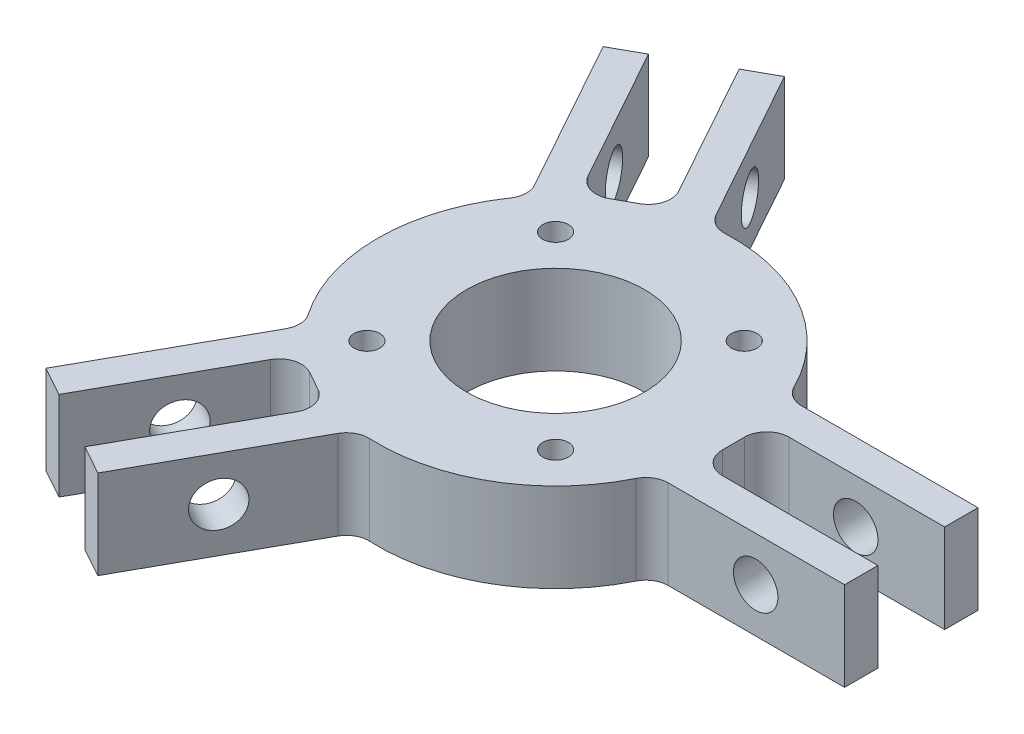
from build123d import *

# Parameters (mm, degrees)
SKETCH1_R                             = 12.7
SKETCH1_R_2                           = 1.8288
BOSS_EXTRUDE1_DEPTH                   = 6.35
F_1_4_0_25_DIAMETER_HOLE1_D           = 6.35
F_1_4_0_25_DIAMETER_HOLE1_ON_FACE_2_D = 6.35
F_1_4_0_25_DIAMETER_HOLE1_ON_FACE_3_D = 6.35
F_1_4_0_25_DIAMETER_HOLE1_ON_FACE_4_D = 6.35
F_1_4_0_25_DIAMETER_HOLE1_ON_FACE_5_D = 6.35
F_1_4_0_25_DIAMETER_HOLE1_ON_FACE_6_D = 6.35
FILLET1_R                             = 3.175


with BuildPart() as part:
    # Sketch1 → Boss-Extrude1 (new, symmetric)
    with BuildSketch(Plane(origin=(0, 0, 0), x_dir=(1, 0, 0), z_dir=(0, 1, 0))):
        with BuildLine():
            Line((25.4, 4.7625), (25.4, -4.7625))
            Line((25.4, -4.7625), (50.8, -4.7625))
            Line((50.8, -4.7625), (50.8, -9.525))
            Line((50.8, -9.525), (23.546430197, -9.525))
            ThreePointArc((23.546430197, -9.525), (12.881044339, -21.891521115), (-3.108809324, -25.209032202))
            Line((-3.108809324, -25.209032202), (-16.344312849, -49.032938546))
            Line((-16.344312849, -49.032938546), (-20.507486876, -46.720064087))
            Line((-20.507486876, -46.720064087), (-8.172156424, -24.516469273))
            Line((-8.172156424, -24.516469273), (-16.498504479, -19.890720354))
            Line((-16.498504479, -19.890720354), (-28.833834931, -42.094315167))
            Line((-28.833834931, -42.094315167), (-32.997008959, -39.781440707))
            Line((-32.997008959, -39.781440707), (-19.761505434, -15.957534364))
            ThreePointArc((-19.761505434, -15.957534364), (-25.4, 0), (-19.761505434, 15.957534364))
            Line((-19.761505434, 15.957534364), (-32.997008959, 39.781440707))
            Line((-32.997008959, 39.781440707), (-28.833834931, 42.094315167))
            Line((-28.833834931, 42.094315167), (-16.498504479, 19.890720354))
            Line((-16.498504479, 19.890720354), (-8.172156424, 24.516469273))
            Line((-8.172156424, 24.516469273), (-20.507486876, 46.720064087))
            Line((-20.507486876, 46.720064087), (-16.344312849, 49.032938546))
            Line((-16.344312849, 49.032938546), (-3.108809324, 25.209032202))
            ThreePointArc((-3.108809324, 25.209032202), (12.881044339, 21.891521115), (23.546430197, 9.525))
            Line((23.546430197, 9.525), (50.8, 9.525))
            Line((50.8, 9.525), (50.8, 4.7625))
            Line((50.8, 4.7625), (25.4, 4.7625))
        make_face()
        with Locations(Location((0, 0, 0), (0, 0, 270))):
            Circle(SKETCH1_R, mode=Mode.SUBTRACT)
        with Locations(Location((-13.470384182, 13.470384182, 0), (0, 0, 270))):
            Circle(SKETCH1_R_2, mode=Mode.SUBTRACT)
        with Locations(Location((13.470384182, 13.470384182, 0), (0, 0, 270))):
            Circle(SKETCH1_R_2, mode=Mode.SUBTRACT)
        with Locations(Location((13.470384182, -13.470384182, 0), (0, 0, 270))):
            Circle(SKETCH1_R_2, mode=Mode.SUBTRACT)
        with Locations(Location((-13.470384182, -13.470384182, 0), (0, 0, 270))):
            Circle(SKETCH1_R_2, mode=Mode.SUBTRACT)
    extrude(amount=BOSS_EXTRUDE1_DEPTH, both=True)

    # 1/4 (0.25) Diameter Hole1 (through all)
    with Locations(Plane(origin=(38.1, 0, -4.7625), x_dir=(0, 1, 0), z_dir=(0, 0, 1))):
        with Locations((0, 0)):
            Hole(F_1_4_0_25_DIAMETER_HOLE1_D / 2)

    # 1/4 (0.25) Diameter Hole1 on face 2 (through all)
    with Locations(Plane(origin=(-14.33982165, 0, -35.61826668), x_dir=(-0.48564310099, 0, -0.874157181782), z_dir=(-0.874157181782, 0, 0.48564310099))):
        with Locations((0, 0)):
            Hole(F_1_4_0_25_DIAMETER_HOLE1_ON_FACE_2_D / 2)

    # 1/4 (0.25) Diameter Hole1 on face 3 (through all)
    with Locations(Plane(origin=(-22.666169705, 0, 30.99251776), x_dir=(-0.48564310099, 0, 0.874157181782), z_dir=(0.874157181782, 0, 0.48564310099))):
        with Locations((1e-09, 0)):
            Hole(F_1_4_0_25_DIAMETER_HOLE1_ON_FACE_3_D / 2)

    # 1/4 (0.25) Diameter Hole1 on face 4 (through all)
    with Locations(Plane(origin=(-14.33982165, 0, 35.61826668), x_dir=(0.48564310099, 0, -0.874157181782), z_dir=(-0.874157181782, 0, -0.48564310099))):
        with Locations((0, 0)):
            Hole(F_1_4_0_25_DIAMETER_HOLE1_ON_FACE_4_D / 2)

    # 1/4 (0.25) Diameter Hole1 on face 5 (through all)
    with Locations(Plane(origin=(-22.666169705, 0, -30.99251776), x_dir=(0.48564310099, 0, 0.874157181782), z_dir=(0.874157181782, 0, -0.48564310099))):
        with Locations((-1e-09, 0)):
            Hole(F_1_4_0_25_DIAMETER_HOLE1_ON_FACE_5_D / 2)

    # 1/4 (0.25) Diameter Hole1 on face 6 (through all)
    with Locations(Plane(origin=(38.1, 0, 4.7625), x_dir=(-1, 0, 0), z_dir=(0, 0, -1))):
        with Locations((0, 0)):
            Hole(F_1_4_0_25_DIAMETER_HOLE1_ON_FACE_6_D / 2)

    # Fillet1
    fillet1_edges = [part.edges().sort_by_distance(p)[0] for p in [
        (25.4, 0, -4.7625),
        (25.4, 0, 4.7625),
        (23.546430197, 0, 9.525),
        (-3.108809324, 0, 25.209032202),
        (-8.172156424, 0, 24.516469273),
        (-16.498504479, 0, 19.890720354),
        (-19.761505434, 0, 15.957534364),
        (-19.761505434, 0, -15.957534364),
        (-16.498504479, 0, -19.890720354),
        (-8.172156424, 0, -24.516469273),
        (-3.108809324, 0, -25.209032202),
        (23.546430197, 0, -9.525),
    ]]
    fillet(fillet1_edges, radius=FILLET1_R)


solid = part.part
